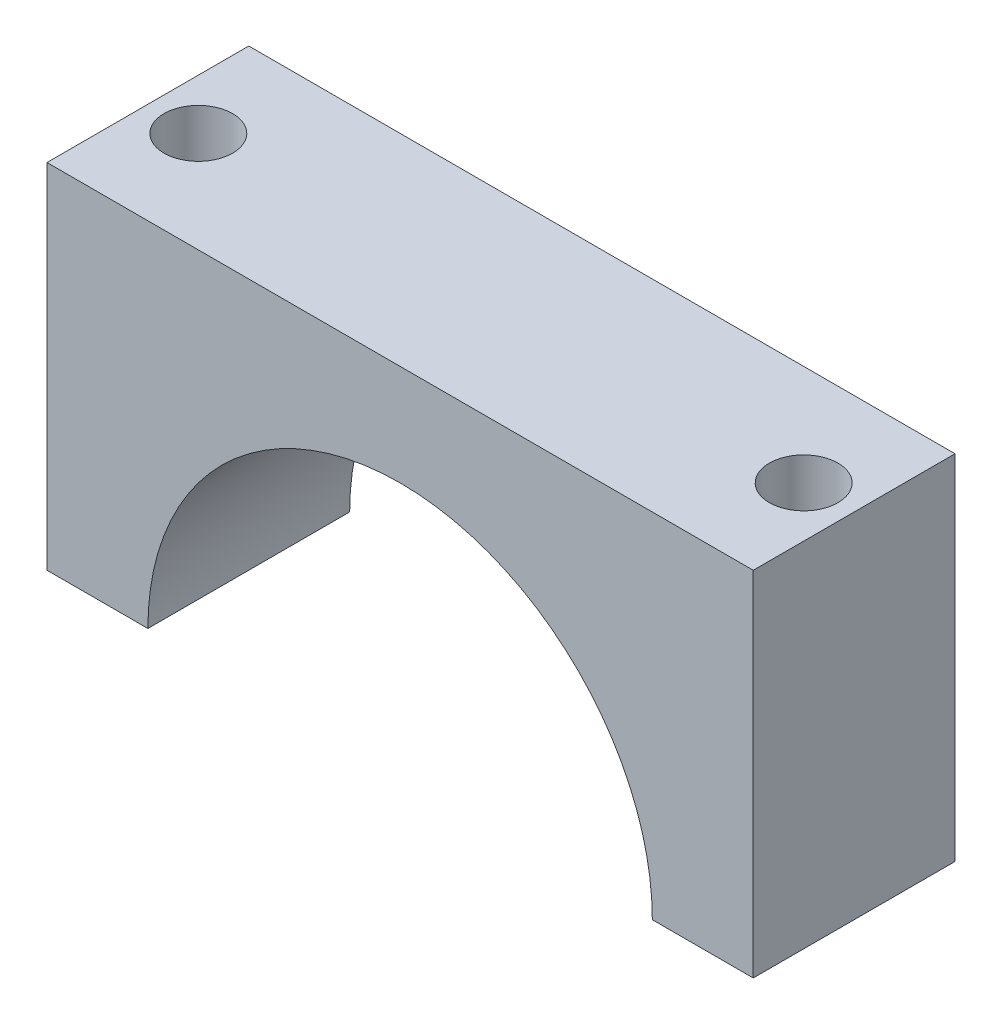
from build123d import *

# Parameters (mm, degrees)
BOSS_EXTRUDE1_DEPTH  = 10
M3_CLEARANCE_HOLE1_D = 3.4


with BuildPart() as part:
    # Sketch2 → Boss-Extrude1 (new body)
    with BuildSketch(Plane.XY):
        with BuildLine():
            Line((12.5, 0), (17.5, 0))
            Line((17.5, 0), (17.5, 17.5))
            Line((17.5, 17.5), (-17.5, 17.5))
            Line((-17.5, 17.5), (-17.5, 0))
            Line((-17.5, 0), (-12.5, 0))
            ThreePointArc((-12.5, 0), (0, 12.5), (12.5, 0))
        make_face()
    extrude(amount=BOSS_EXTRUDE1_DEPTH)

    # M3 Clearance Hole1 (through all)
    with Locations(Plane(origin=(0, 17.5, 0), x_dir=(1, 0, 0), z_dir=(0, 1, 0))):
        with Locations((-15, -5), (15, -5)):
            Hole(M3_CLEARANCE_HOLE1_D / 2)


solid = part.part
